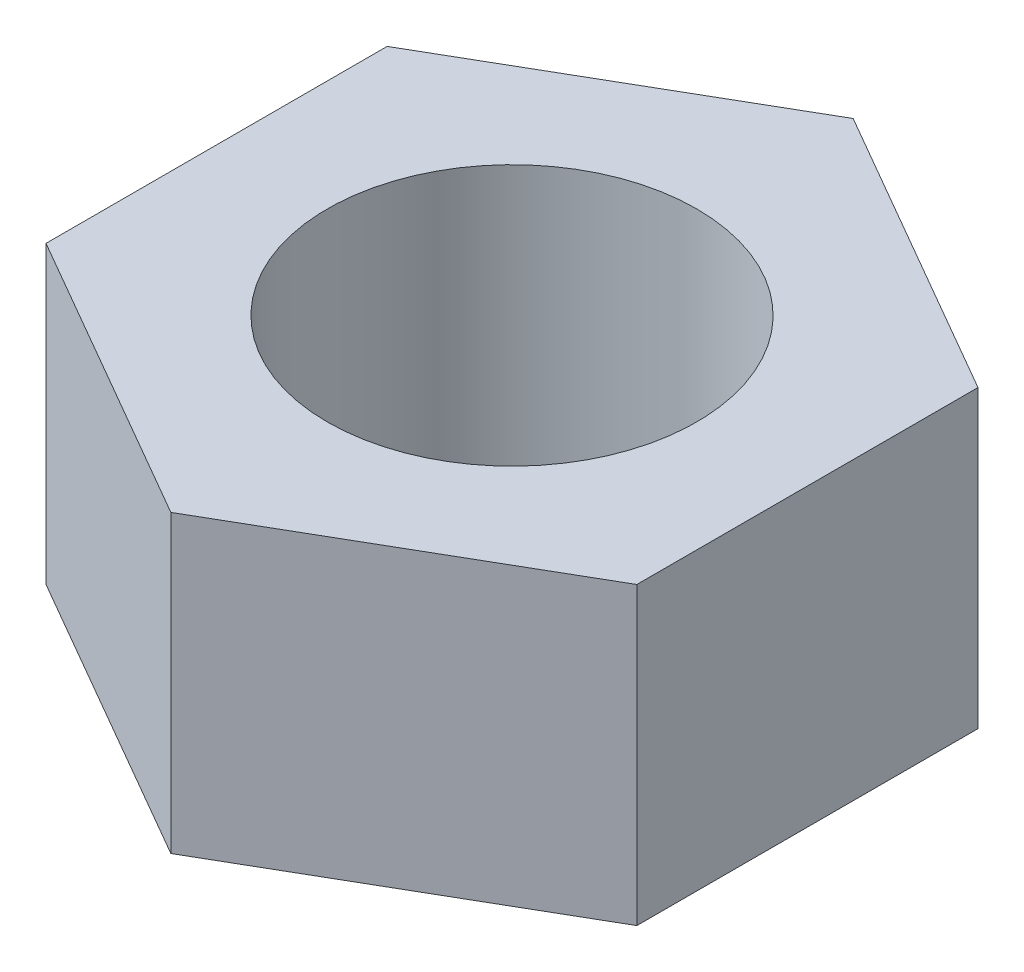
from build123d import *

# Parameters (mm, degrees)
SKETCH_1_R      = 2.5
EXTRUDE_1_DEPTH = 4


with BuildPart() as part:
    # 草图1 → 凸台-拉伸1 (new body)
    with BuildSketch(Plane(origin=(0, 0, 0), x_dir=(1, 0, 0), z_dir=(0, 1, 0))):
        Polygon((0, 4.618802154), (-4, 2.309401077), (-4, -2.309401077), (0, -4.618802154), (4, -2.309401077), (4, 2.309401077), align=None)
        with Locations(Location((0, 0, 0), (0, 0, 270))):
            Circle(SKETCH_1_R, mode=Mode.SUBTRACT)
    extrude(amount=EXTRUDE_1_DEPTH)


solid = part.part
